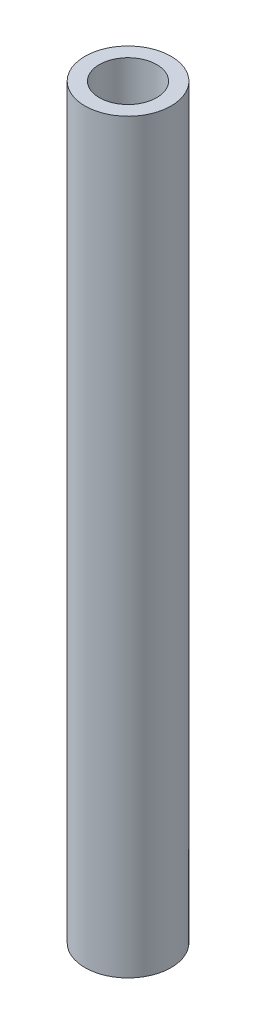
from build123d import *

# Parameters (mm, degrees)
SKETCH1_R           = 3
SKETCH1_R_2         = 2
BOSS_EXTRUDE1_DEPTH = 52


with BuildPart() as part:
    # Sketch1 → Boss-Extrude1 (new body)
    with BuildSketch(Plane(origin=(0, 0, 0), x_dir=(1, 0, 0), z_dir=(0, 1, 0))):
        with Locations(Location((0, 0, 0), (0, 0, 90))):
            Circle(SKETCH1_R)
        with Locations(Location((0, 0, 0), (0, 0, 90))):
            Circle(SKETCH1_R_2, mode=Mode.SUBTRACT)
    extrude(amount=BOSS_EXTRUDE1_DEPTH)


solid = part.part
